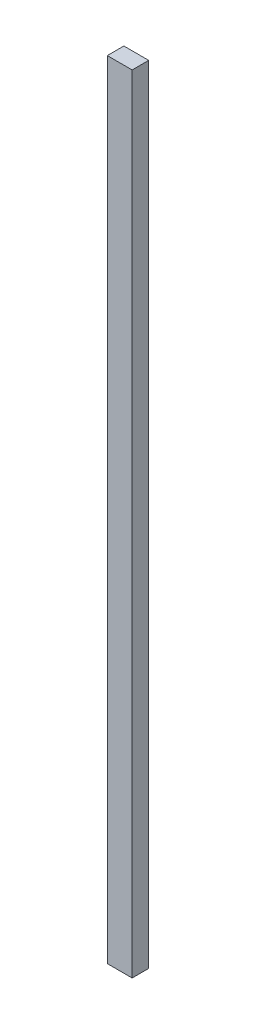
from build123d import *

# Parameters (mm, degrees)
SKETCH1_W           = 12
SKETCH1_H           = 379.5
BOSS_EXTRUDE1_DEPTH = 8


with BuildPart() as part:
    # Sketch1 → Boss-Extrude1 (new body)
    with BuildSketch(Plane(origin=(0, 0, -32.828828766), x_dir=(-1, 0, 0), z_dir=(0, 0, -1))):
        with Locations((0, 390.879425724)):
            Rectangle(SKETCH1_W, SKETCH1_H)
    extrude(amount=BOSS_EXTRUDE1_DEPTH)


solid = part.part
